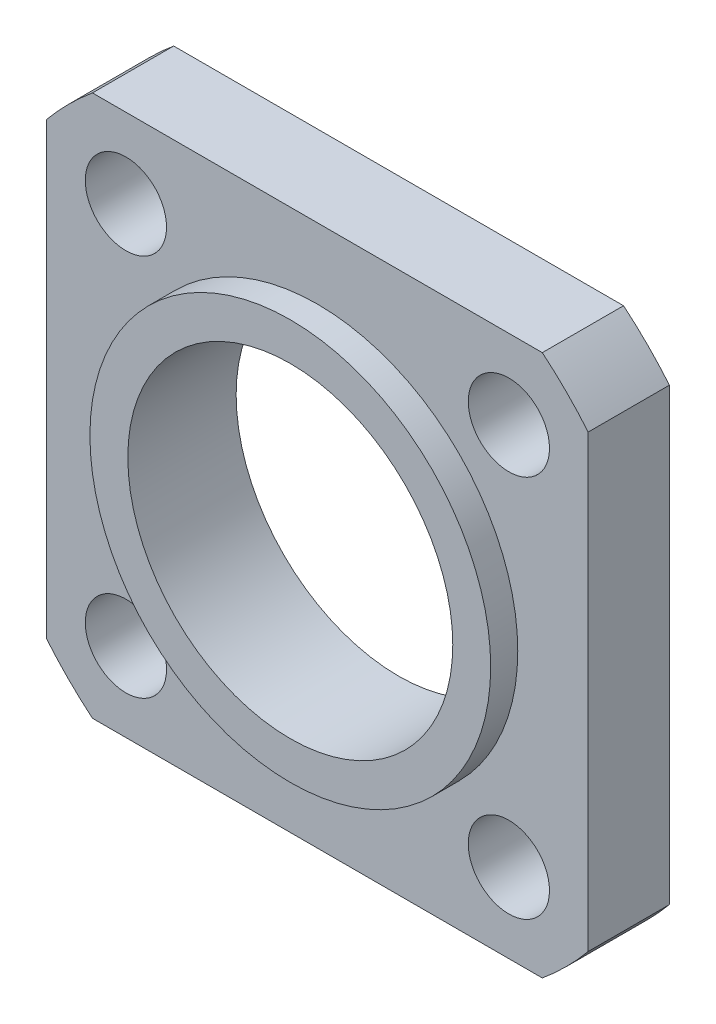
from build123d import *

# Parameters (mm, degrees)
SKETCH_1_R          = 13
SKETCH_1_R_2        = 6
SKETCH_1_R_3        = 1.5
EXTRUDE_1_DEPTH     = 3
SKETCH_2_R          = 7.4
SKETCH_2_R_2        = 6
EXTRUDE_2_DEPTH     = 1
CUT_EXTRUDE_START   = -41
CUT_EXTRUDE_1_DEPTH = 41


with BuildPart() as part:
    # 草图1 → 凸台-拉伸1 (new body)
    with BuildSketch(Plane.XY):
        Circle(SKETCH_1_R)
        Circle(SKETCH_1_R_2, mode=Mode.SUBTRACT)
        with Locations((-7.071067812, 7.071067812)):
            Circle(SKETCH_1_R_3, mode=Mode.SUBTRACT)
        with Locations((7.071067812, 7.071067812)):
            Circle(SKETCH_1_R_3, mode=Mode.SUBTRACT)
        with Locations((7.071067812, -7.071067812)):
            Circle(SKETCH_1_R_3, mode=Mode.SUBTRACT)
        with Locations((-7.071067812, -7.071067812)):
            Circle(SKETCH_1_R_3, mode=Mode.SUBTRACT)
    extrude(amount=EXTRUDE_1_DEPTH)

    # 草图2 → 凸台-拉伸2 (add)
    with BuildSketch(Plane.XY.offset(3)):
        Circle(SKETCH_2_R)
        Circle(SKETCH_2_R_2, mode=Mode.SUBTRACT)
    extrude(amount=EXTRUDE_2_DEPTH)

    # 草图3 → 切除-拉伸1 (cut)
    with BuildSketch(Plane.XY.offset(3).offset(CUT_EXTRUDE_START)):
        with BuildLine():
            Line((-8.306623863, 10), (8.306623863, 10))
            ThreePointArc((8.306623863, 10), (0, 13), (-8.306623863, 10))
        make_face()
        with BuildLine():
            Line((10, 8.306623863), (10, -8.306623863))
            ThreePointArc((10, -8.306623863), (13, 0), (10, 8.306623863))
        make_face()
        with BuildLine():
            Line((8.306623863, -10), (-8.306623863, -10))
            ThreePointArc((-8.306623863, -10), (0, -13), (8.306623863, -10))
        make_face()
        with BuildLine():
            Line((-10, -8.306623863), (-10, 8.306623863))
            ThreePointArc((-10, 8.306623863), (-13, 0), (-10, -8.306623863))
        make_face()
    extrude(amount=CUT_EXTRUDE_1_DEPTH, mode=Mode.SUBTRACT)


solid = part.part
